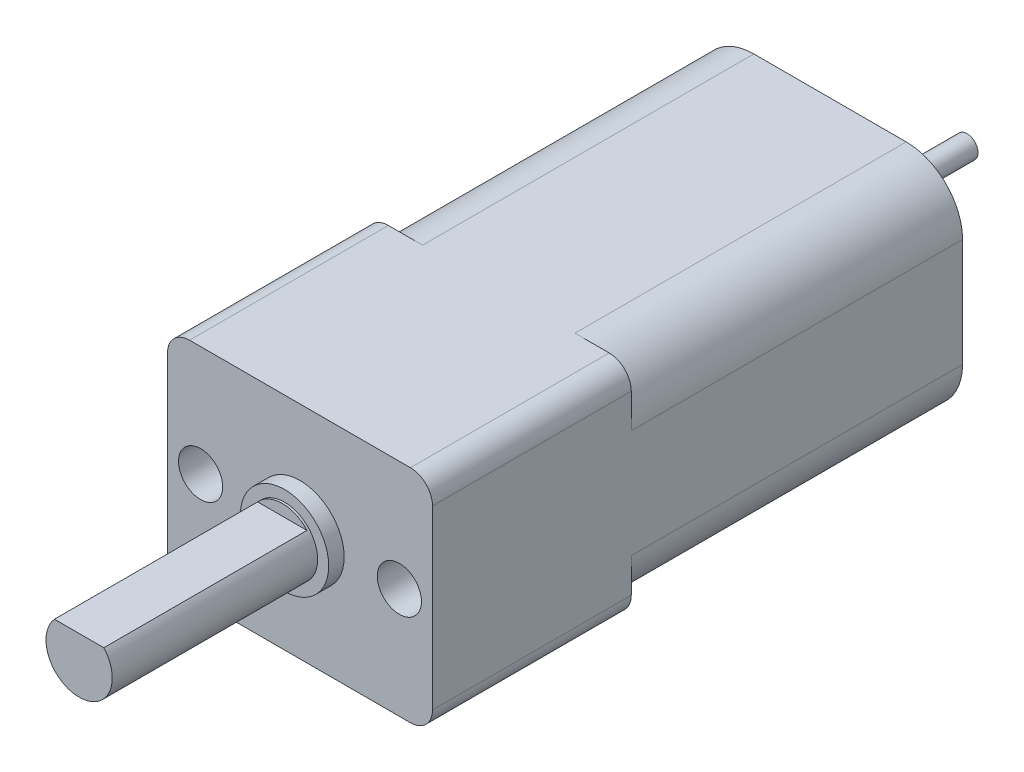
from build123d import *

# Parameters (mm, degrees)
BOSS_EXTRUDE1_DEPTH        = 15
BOSS_EXTRUDE2_DEPTH        = 9
SKETCH3_R                  = 2
BOSS_EXTRUDE3_DEPTH        = 0.7
SKETCH4_R                  = 1.5
BOSS_EXTRUDE4_DEPTH        = 9.3
SKETCH5_W                  = 3
SKETCH5_H                  = 1
CUT_EXTRUDE1_DEPTH         = 9.2
SKETCH6_R                  = 2.5
BOSS_EXTRUDE5_DEPTH        = 1.2
SKETCH7_R                  = 0.5
BOSS_EXTRUDE6_DEPTH        = 5
M1_6_CLEARANCE_HOLE1_D     = 2
M1_6_CLEARANCE_HOLE1_DEPTH = 7
M1_6_CLEARANCE_HOLE1_TIP   = 0.600860619


with BuildPart() as part:
    # Sketch1 → Boss-Extrude1 (new body)
    with BuildSketch(Plane.XY):
        with BuildLine():
            Line((3.45, -5), (-3.45, -5))
            ThreePointArc((-3.45, -5), (-5.253122292, -4.253122292), (-6, -2.45))
            Line((-6, -2.45), (-6, 2.45))
            ThreePointArc((-6, 2.45), (-5.253122292, 4.253122292), (-3.45, 5))
            Line((-3.45, 5), (3.45, 5))
            ThreePointArc((3.45, 5), (5.253122292, 4.253122292), (6, 2.45))
            Line((6, 2.45), (6, -2.45))
            ThreePointArc((6, -2.45), (5.253122292, -4.253122292), (3.45, -5))
        make_face()
    extrude(amount=BOSS_EXTRUDE1_DEPTH)

    # Sketch2 → Boss-Extrude2 (add)
    with BuildSketch(Plane.XY.offset(15)):
        with BuildLine():
            Line((5, -5), (-5, -5))
            ThreePointArc((-5, -5), (-5.707106781, -4.707106781), (-6, -4))
            Line((-6, -4), (-6, 4))
            ThreePointArc((-6, 4), (-5.707106781, 4.707106781), (-5, 5))
            Line((-5, 5), (5, 5))
            ThreePointArc((5, 5), (5.707106781, 4.707106781), (6, 4))
            Line((6, 4), (6, -4))
            ThreePointArc((6, -4), (5.707106781, -4.707106781), (5, -5))
        make_face()
    extrude(amount=BOSS_EXTRUDE2_DEPTH)

    # Sketch3 → Boss-Extrude3 (add)
    with BuildSketch(Plane.XY.offset(24)):
        Circle(SKETCH3_R)
    extrude(amount=BOSS_EXTRUDE3_DEPTH)

    # Sketch4 → Boss-Extrude4 (add)
    with BuildSketch(Plane.XY.offset(24.7)):
        Circle(SKETCH4_R)
    extrude(amount=BOSS_EXTRUDE4_DEPTH)

    # Sketch5 → Cut-Extrude1 (cut)
    with BuildSketch(Plane.XY.offset(34)):
        with Locations((0, 1.5)):
            Rectangle(SKETCH5_W, SKETCH5_H)
    extrude(amount=-CUT_EXTRUDE1_DEPTH, mode=Mode.SUBTRACT)

    # Sketch6 → Boss-Extrude5 (add)
    with BuildSketch(Plane(origin=(0, 0, 0), x_dir=(-1, 0, 0), z_dir=(0, 0, -1))):
        Circle(SKETCH6_R)
    extrude(amount=BOSS_EXTRUDE5_DEPTH)

    # Sketch7 → Boss-Extrude6 (add)
    with BuildSketch(Plane(origin=(0, 0, -1.2), x_dir=(-1, 0, 0), z_dir=(0, 0, -1))):
        Circle(SKETCH7_R)
    extrude(amount=BOSS_EXTRUDE6_DEPTH)

    # M1.6 Clearance Hole1
    with Locations(Plane.XY.offset(24)):
        with Locations((-4.5, 0), (4.5, 0)):
            Hole(M1_6_CLEARANCE_HOLE1_D / 2, depth=M1_6_CLEARANCE_HOLE1_DEPTH)
            with Locations((0, 0, -(M1_6_CLEARANCE_HOLE1_DEPTH + M1_6_CLEARANCE_HOLE1_TIP / 2))):  # 118° drill point
                Cone(0, M1_6_CLEARANCE_HOLE1_D / 2, M1_6_CLEARANCE_HOLE1_TIP, mode=Mode.SUBTRACT)


solid = part.part
